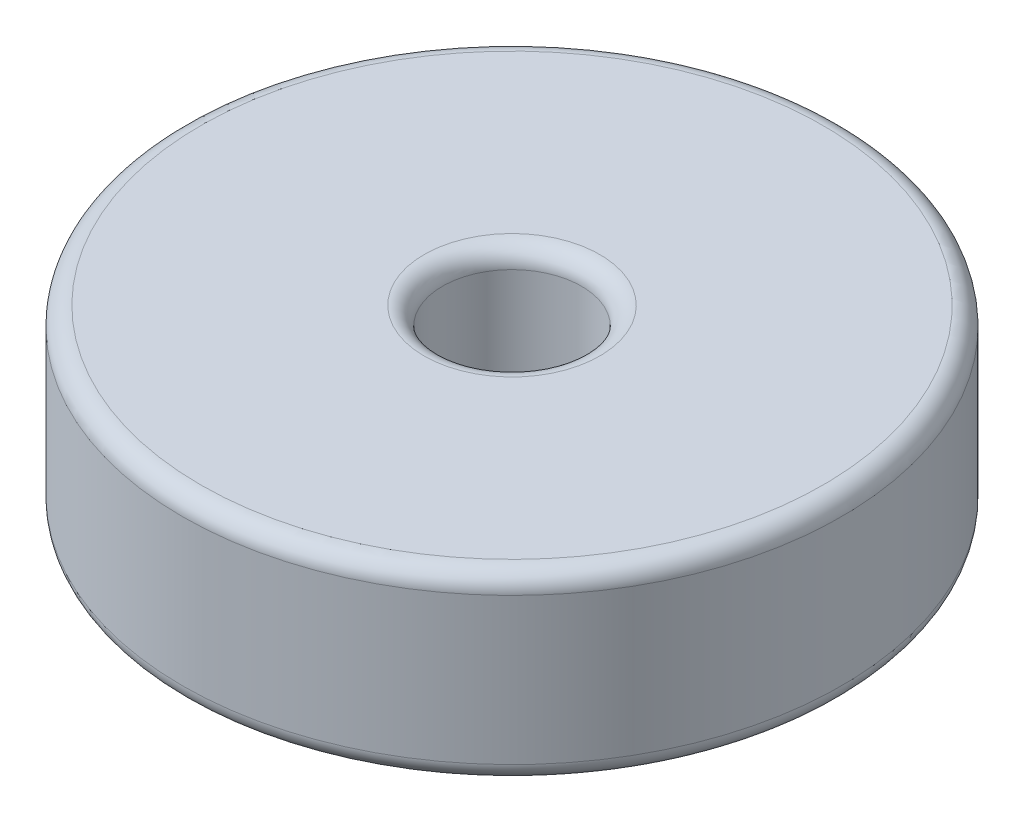
from build123d import *

# Parameters (mm, degrees)
SKETCH1_R           = 11.43
SKETCH1_R_2         = 2.413
BOSS_EXTRUDE1_DEPTH = 3.175
FILLET1_R           = 0.635


with BuildPart() as part:
    # Sketch1 → Boss-Extrude1 (new, symmetric)
    with BuildSketch(Plane(origin=(0, 0, 0), x_dir=(1, 0, 0), z_dir=(0, 1, 0))):
        with Locations(Location((0, 0, 0), (0, 0, 270))):
            Circle(SKETCH1_R)
        with Locations(Location((0, 0, 0), (0, 0, 270))):
            Circle(SKETCH1_R_2, mode=Mode.SUBTRACT)
    extrude(amount=BOSS_EXTRUDE1_DEPTH, both=True)

    # Fillet1
    fillet1_edges = [part.edges().sort_by_distance(p)[0] for p in [
        (0, -3.175, -11.43),
        (0, 3.175, -11.43),
        (0, -3.175, -2.413),
        (0, 3.175, -2.413),
    ]]
    fillet(fillet1_edges, radius=FILLET1_R)


solid = part.part
